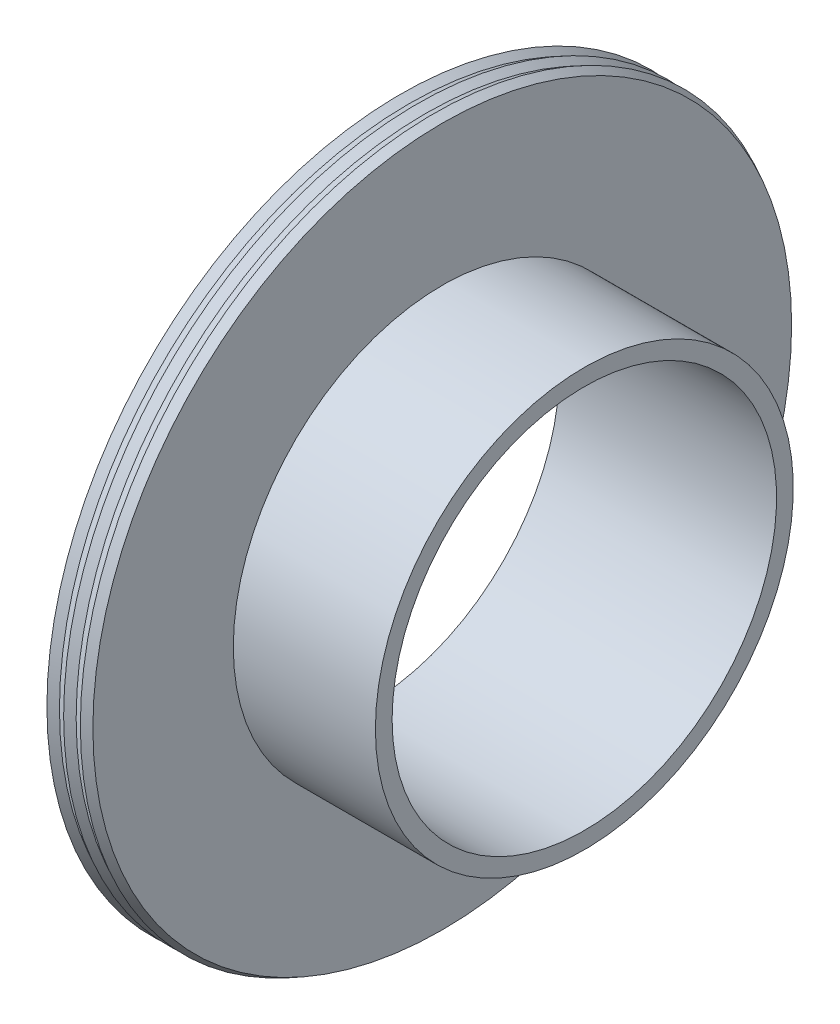
from build123d import *


with BuildPart() as part:
    # 草图1 → 旋转1 (revolve)
    with BuildSketch(Plane.XY, mode=Mode.PRIVATE) as revolve_1_sk:
        Polygon((0, 25), (0, 23), (26, 23), (26, 25), (9, 25), (9, 41.8), (8, 42.3), (7, 41.8), (6, 42.3), (5, 41.8), (4, 42.3), (4, 25), align=None)
    revolve(revolve_1_sk.sketch.rotate(Axis((-59.659258107, 0, 0), (1, 0, 0)), 90), axis=Axis((-59.659258107, 0, 0), (1, 0, 0)))


solid = part.part
